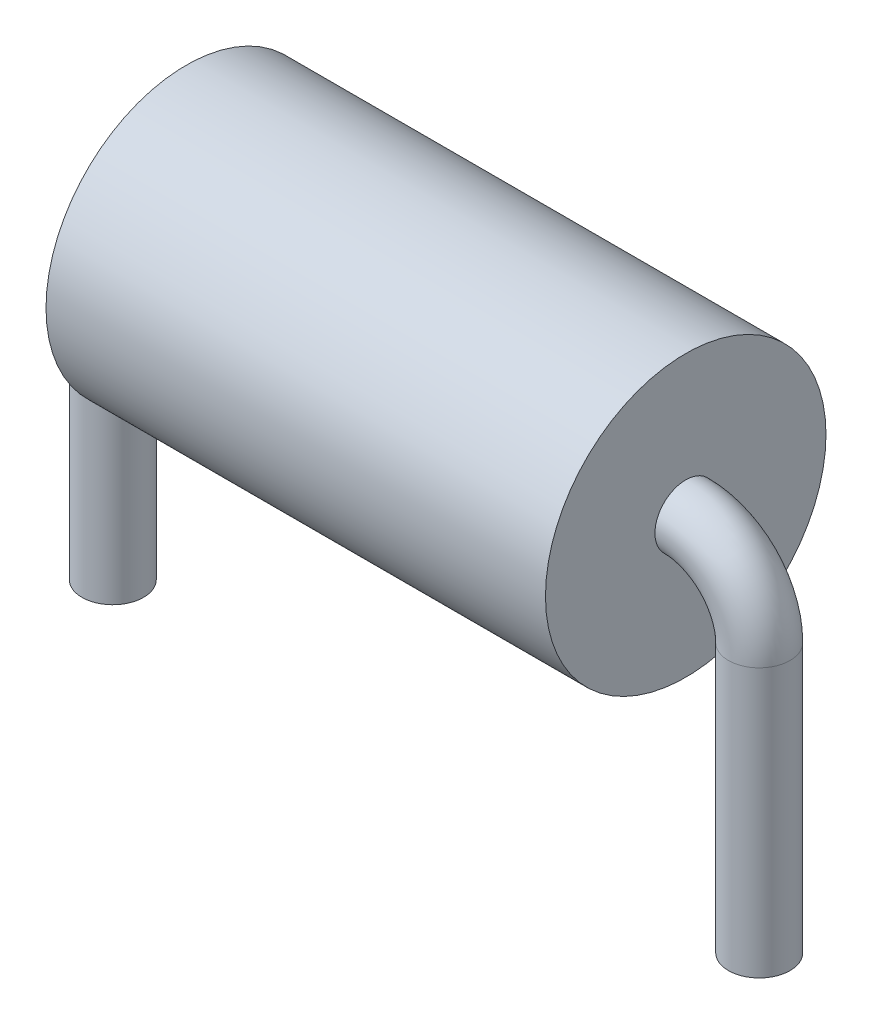
from build123d import *

# Parameters (mm, degrees)
SKETCH1_R           = 2.6035
BOSS_EXTRUDE1_DEPTH = 4.6355
SKETCH3_R           = 0.5715


with BuildPart() as part:
    # Sketch1 → Boss-Extrude1 (new, symmetric)
    with BuildSketch(Plane(origin=(0, 0, 0), x_dir=(0, 0, -1), z_dir=(1, 0, 0))):
        Circle(SKETCH1_R)
    extrude(amount=BOSS_EXTRUDE1_DEPTH, both=True)

    # Sweep1: sweep along a path in Sketch2
    with BuildLine(Plane.XY) as sweep1_path:
        Line((-6, -6.35), (-6, -1.3645))
        ThreePointArc((-6, -1.3645), (-5.600347203, -0.399652797), (-4.6355, 0))
        Line((-4.6355, 0), (4.6355, 0))
        ThreePointArc((4.6355, 0), (5.600347203, -0.399652797), (6, -1.3645))
        Line((6, -1.3645), (6, -6.35))
    # Sketch3 → Sweep1 (sweep)
    with BuildSketch(Plane(origin=(-6, -6.35, 0), x_dir=(1, 0, 0), z_dir=(0, 1, 0))):
        Circle(SKETCH3_R)
    sweep(path=sweep1_path.line)


solid = part.part
